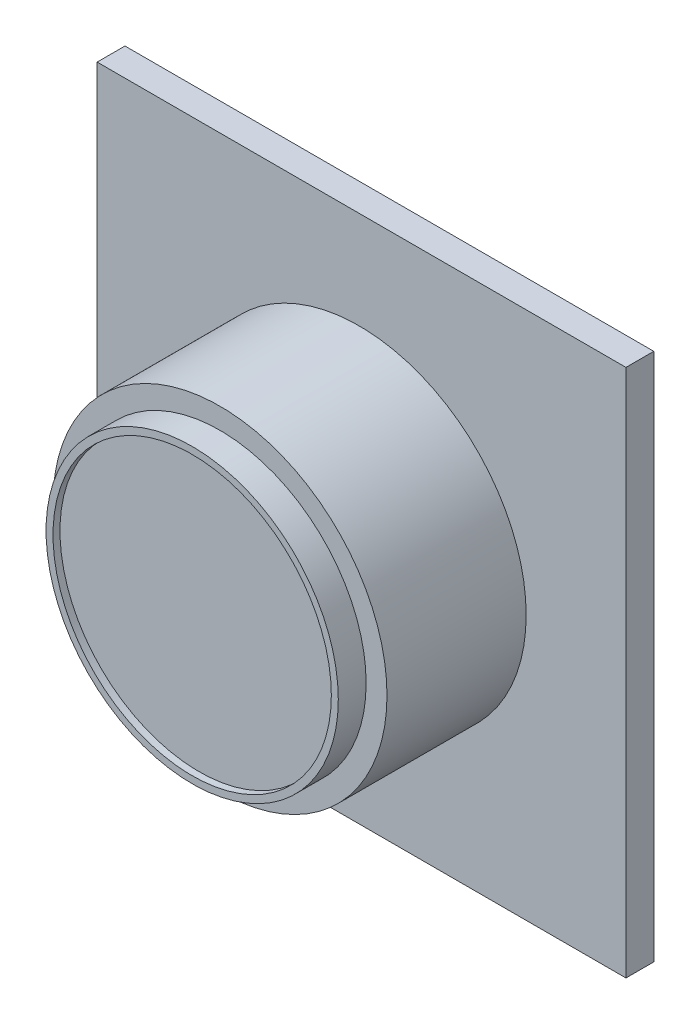
from build123d import *

# Parameters (mm, degrees)
SKETCH1_W           = 19
SKETCH1_H           = 19
BOSS_EXTRUDE1_DEPTH = 1
SKETCH2_R           = 6
BOSS_EXTRUDE2_DEPTH = 5
SKETCH3_R           = 5.25
SKETCH3_R_2         = 5
BOSS_EXTRUDE5_DEPTH = 1
SKETCH6_R           = 5
CUT_EXTRUDE3_DEPTH  = 16.203073736
SKETCH7_R           = 5.25
BOSS_EXTRUDE6_DEPTH = 0.75


with BuildPart() as part:
    # Sketch1 → Boss-Extrude1 (new body)
    with BuildSketch(Plane.XY):
        with Locations((0.085585586, 0)):
            Rectangle(SKETCH1_W, SKETCH1_H)
    extrude(amount=BOSS_EXTRUDE1_DEPTH)

    # Sketch2 → Boss-Extrude2 (add)
    with BuildSketch(Plane.XY.offset(1)):
        Circle(SKETCH2_R)
    extrude(amount=BOSS_EXTRUDE2_DEPTH)

    # Sketch3 → Boss-Extrude5 (add)
    with BuildSketch(Plane.XY.offset(6)):
        Circle(SKETCH3_R)
        Circle(SKETCH3_R_2, mode=Mode.SUBTRACT)
    extrude(amount=BOSS_EXTRUDE5_DEPTH)

    # Sketch6 → Cut-Extrude3 (cut, through all)
    with BuildSketch(Plane.XY.offset(7)):
        Circle(SKETCH6_R)
    extrude(amount=-CUT_EXTRUDE3_DEPTH, mode=Mode.SUBTRACT)

    # Sketch7 → Boss-Extrude6 (add)
    with BuildSketch(Plane.XY.offset(6)):
        Circle(SKETCH7_R)
    extrude(amount=BOSS_EXTRUDE6_DEPTH)


solid = part.part
